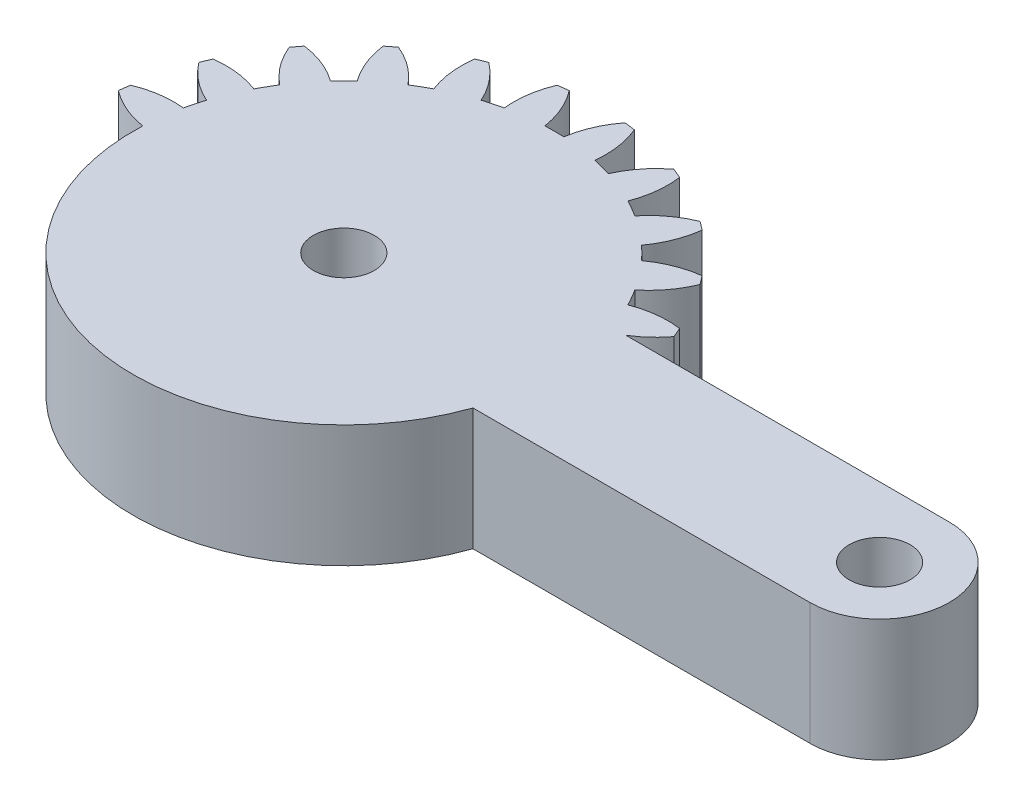
from build123d import *

# Parameters (mm, degrees)
SKETCH1_R           = 1.75
BOSS_EXTRUDE1_DEPTH = 7


with BuildPart() as part:
    # Sketch1 → Boss-Extrude1 (new body)
    with BuildSketch(Plane(origin=(0, 4, 0), x_dir=(1, 0, 0), z_dir=(0, 1, 0))):
        with BuildLine():
            Line((1.305695063, -4), (20.643657446, -4))
            ThreePointArc((20.643657446, -4), (24.643657446, 0), (20.643657446, 4))
            Line((20.643657446, 4), (2.081641936, 4))
            ThreePointArc((2.081641936, 4), (2.861028333, 4.588201733), (3.521749436, 5.30713988))
            ThreePointArc((3.521749436, 5.30713988), (3.405395609, 5.596745198), (3.282888305, 5.883801663))
            ThreePointArc((3.282888305, 5.883801663), (1.93527598, 5.894040025), (0.627094961, 5.57027124))
            ThreePointArc((0.627094961, 5.57027124), (0.366286148, 6.046375), (0.084372603, 6.510293938))
            ThreePointArc((0.084372603, 6.510293938), (1.018855105, 7.48132754), (1.683794586, 8.65351323))
            ThreePointArc((1.683794586, 8.65351323), (1.496450048, 8.903135899), (1.303821399, 9.148703928))
            ThreePointArc((1.303821399, 9.148703928), (-0.000522033, 8.809805691), (-1.180330337, 8.158486898))
            ThreePointArc((-1.180330337, 8.158486898), (-1.555477026, 8.550865528), (-1.947855656, 8.926012217))
            ThreePointArc((-1.947855656, 8.926012217), (-1.296536862, 10.105820521), (-0.957638625, 11.410163953))
            ThreePointArc((-0.957638625, 11.410163953), (-1.203206655, 11.602792602), (-1.452829324, 11.79013714))
            ThreePointArc((-1.452829324, 11.79013714), (-2.625015014, 11.125197659), (-3.596048616, 10.190715157))
            ThreePointArc((-3.596048616, 10.190715157), (-4.059967554, 10.472628702), (-4.536071314, 10.733437515))
            ThreePointArc((-4.536071314, 10.733437515), (-4.212302529, 12.041618533), (-4.222540891, 13.389230859))
            ThreePointArc((-4.222540891, 13.389230859), (-4.509597355, 13.511738163), (-4.799202674, 13.62809199))
            ThreePointArc((-4.799202674, 13.62809199), (-5.759348103, 12.682425791), (-6.455432668, 11.528463019))
            ThreePointArc((-6.455432668, 11.528463019), (-6.976508546, 11.680699536), (-7.503891752, 11.809396783))
            ThreePointArc((-7.503891752, 11.809396783), (-7.529737283, 13.156800143), (-7.888414517, 14.455843809))
            ThreePointArc((-7.888414517, 14.455843809), (-8.197396993, 14.499881098), (-8.507248835, 14.537314892))
            ThreePointArc((-8.507248835, 14.537314892), (-9.18992168, 13.375367565), (-9.563620196, 12.080565177))
            ThreePointArc((-9.563620196, 12.080565177), (-10.106342554, 12.09275), (-10.649064912, 12.080565177))
            ThreePointArc((-10.649064912, 12.080565177), (-11.022763428, 13.375367565), (-11.705436272, 14.537314892))
            ThreePointArc((-11.705436272, 14.537314892), (-12.015288115, 14.499881098), (-12.324270591, 14.455843809))
            ThreePointArc((-12.324270591, 14.455843809), (-12.682947825, 13.156800143), (-12.708793355, 11.809396783))
            ThreePointArc((-12.708793355, 11.809396783), (-13.236176561, 11.680699536), (-13.757252439, 11.528463019))
            ThreePointArc((-13.757252439, 11.528463019), (-14.453337005, 12.682425791), (-15.413482434, 13.62809199))
            ThreePointArc((-15.413482434, 13.62809199), (-15.703087752, 13.511738163), (-15.990144217, 13.389230859))
            ThreePointArc((-15.990144217, 13.389230859), (-16.000382579, 12.041618533), (-15.676613793, 10.733437515))
            ThreePointArc((-15.676613793, 10.733437515), (-16.152717554, 10.472628702), (-16.616636492, 10.190715157))
            ThreePointArc((-16.616636492, 10.190715157), (-17.587670094, 11.125197659), (-18.759855783, 11.79013714))
            ThreePointArc((-18.759855783, 11.79013714), (-19.009478453, 11.602792602), (-19.255046482, 11.410163953))
            ThreePointArc((-19.255046482, 11.410163953), (-18.916148245, 10.105820521), (-18.264829452, 8.926012217))
            ThreePointArc((-18.264829452, 8.926012217), (-18.657208082, 8.550865528), (-19.032354771, 8.158486898))
            ThreePointArc((-19.032354771, 8.158486898), (-20.212163074, 8.809805691), (-21.516506507, 9.148703928))
            ThreePointArc((-21.516506507, 9.148703928), (-21.709135156, 8.903135899), (-21.896479694, 8.65351323))
            ThreePointArc((-21.896479694, 8.65351323), (-21.231540213, 7.48132754), (-20.297057711, 6.510293938))
            ThreePointArc((-20.297057711, 6.510293938), (-20.578971255, 6.046375), (-20.839780068, 5.57027124))
            ThreePointArc((-20.839780068, 5.57027124), (-22.147961087, 5.894040025), (-23.495573413, 5.883801663))
            ThreePointArc((-23.495573413, 5.883801663), (-23.618080717, 5.596745198), (-23.734434544, 5.30713988))
            ThreePointArc((-23.734434544, 5.30713988), (-22.788768345, 4.346994451), (-21.634805572, 3.650909885))
            ThreePointArc((-21.634805572, 3.650909885), (-21.78704209, 3.129834008), (-21.915739337, 2.602450802))
            ThreePointArc((-21.915739337, 2.602450802), (-23.263142697, 2.576605271), (-24.562186363, 2.217928037))
            ThreePointArc((-24.562186363, 2.217928037), (-24.606223651, 1.908945561), (-24.643657446, 1.599093719))
            ThreePointArc((-24.643657446, 1.599093719), (-23.481710119, 0.916420874), (-22.186907731, 0.542722358))
            ThreePointArc((-22.186907731, 0.542722358), (-12.402167869, -11.872817218), (1.305695063, -4))
        make_face()
        with Locations(Location((20.643657446, 0, 0), (0, 0, 90))):
            Circle(SKETCH1_R, mode=Mode.SUBTRACT)
        with Locations(Location((-10.106342554, 0, 0), (0, 0, 90))):
            Circle(SKETCH1_R, mode=Mode.SUBTRACT)
    extrude(amount=-BOSS_EXTRUDE1_DEPTH)


solid = part.part
